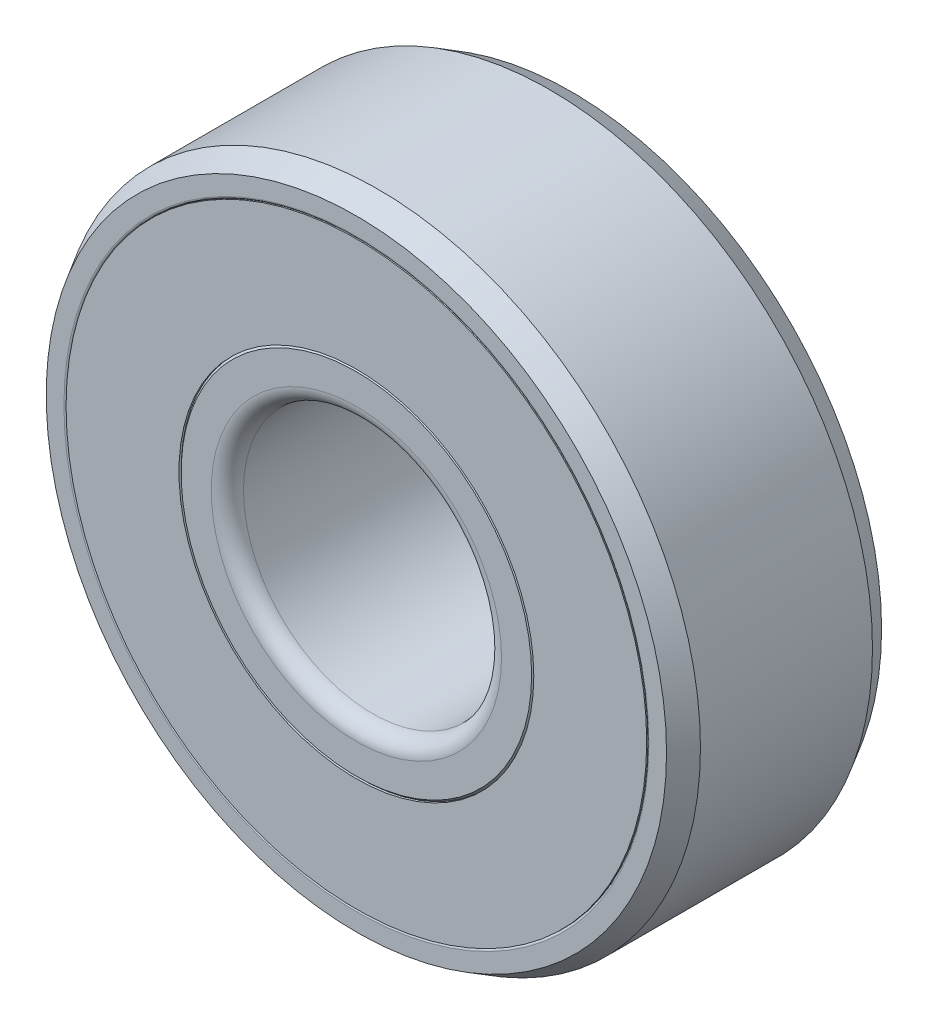
from build123d import *

# Parameters (mm, degrees)
SKETCH4_W         = 0.515625
SKETCH4_H         = 2.625
CIRPATTERN1_COUNT = 7


with BuildPart() as part:
    # Sketch3 → Revolve1 (revolve)
    with BuildSketch(Plane(origin=(0, 0, 0), x_dir=(0, 0, -1), z_dir=(1, 0, 0)), mode=Mode.PRIVATE) as revolve1_sk:
        with BuildLine():
            Line((-2, -7.5), (2, -7.5))
            Line((2, -7.5), (2.5, -7.211324865))
            Line((2.5, -7.211324865), (2.5, -6.8))
            ThreePointArc((2.5, -6.8), (2.485355339, -6.764644661), (2.45, -6.75))
            Line((2.45, -6.75), (1.25, -6.75))
            ThreePointArc((1.25, -6.75), (0, -7.25), (-1.25, -6.75))
            Line((-1.25, -6.75), (-2.45, -6.75))
            ThreePointArc((-2.45, -6.75), (-2.485355339, -6.764644661), (-2.5, -6.8))
            Line((-2.5, -6.8), (-2.5, -7.211324865))
            Line((-2.5, -7.211324865), (-2, -7.5))
        make_face()
        with BuildLine():
            Line((-2.125, -3), (2.125, -3))
            ThreePointArc((2.125, -3), (2.390165043, -3.109834957), (2.5, -3.375))
            Line((2.5, -3.375), (2.5, -4.075))
            Line((2.5, -4.075), (2.45, -4.125))
            Line((2.45, -4.125), (1.25, -4.125))
            ThreePointArc((1.25, -4.125), (0, -3.625), (-1.25, -4.125))
            Line((-1.25, -4.125), (-2.45, -4.125))
            Line((-2.45, -4.125), (-2.5, -4.075))
            Line((-2.5, -4.075), (-2.5, -3.375))
            ThreePointArc((-2.5, -3.375), (-2.390165043, -3.109834957), (-2.125, -3))
        make_face()
    revolve(revolve1_sk.sketch.rotate(Axis((0, 0, 2.5), (0, 0, -1)), 270), axis=Axis((0, 0, 2.5), (0, 0, -1)))


with BuildPart() as body_2:
    # Sketch4 → Revolve2 (revolve)
    with BuildSketch(Plane(origin=(0, 0, 0), x_dir=(0, 0, -1), z_dir=(1, 0, 0)), mode=Mode.PRIVATE) as revolve2_sk:
        with Locations((-2.2421875, -5.4375)):
            Rectangle(SKETCH4_W, SKETCH4_H)
    revolve(revolve2_sk.sketch.rotate(Axis((0, 0, 2.5), (0, 0, -1)), 270), axis=Axis((0, 0, 2.5), (0, 0, -1)))


with BuildPart() as body_3:
    # Sketch5 → Revolve3 (revolve)
    with BuildSketch(Plane(origin=(0, 0, 0), x_dir=(0, 0, -1), z_dir=(1, 0, 0))):
        with BuildLine():
            Line((0, -3.625), (0, -7.25))
            ThreePointArc((0, -7.25), (-1.8125, -5.4375), (0, -3.625))
        make_face()
    revolve(axis=Axis((0, 0, 0), (0, -1, 0)))


with BuildPart() as cirpattern1_1:
    # CirPattern1: pattern copy
    add(body_3.part.rotate(Axis((0, 0, 0), (0, 0, 1)), 1 * 360 / CIRPATTERN1_COUNT))


with BuildPart() as cirpattern1_2:
    # CirPattern1: pattern copy
    add(body_3.part.rotate(Axis((0, 0, 0), (0, 0, 1)), 2 * 360 / CIRPATTERN1_COUNT))


with BuildPart() as cirpattern1_3:
    # CirPattern1: pattern copy
    add(body_3.part.rotate(Axis((0, 0, 0), (0, 0, 1)), 3 * 360 / CIRPATTERN1_COUNT))


with BuildPart() as cirpattern1_4:
    # CirPattern1: pattern copy
    add(body_3.part.rotate(Axis((0, 0, 0), (0, 0, 1)), 4 * 360 / CIRPATTERN1_COUNT))


with BuildPart() as cirpattern1_5:
    # CirPattern1: pattern copy
    add(body_3.part.rotate(Axis((0, 0, 0), (0, 0, 1)), 5 * 360 / CIRPATTERN1_COUNT))


with BuildPart() as cirpattern1_6:
    # CirPattern1: pattern copy
    add(body_3.part.rotate(Axis((0, 0, 0), (0, 0, 1)), 6 * 360 / CIRPATTERN1_COUNT))


solid = Compound([part.part, body_2.part, body_3.part, cirpattern1_1.part, cirpattern1_2.part, cirpattern1_3.part, cirpattern1_4.part, cirpattern1_5.part, cirpattern1_6.part])
